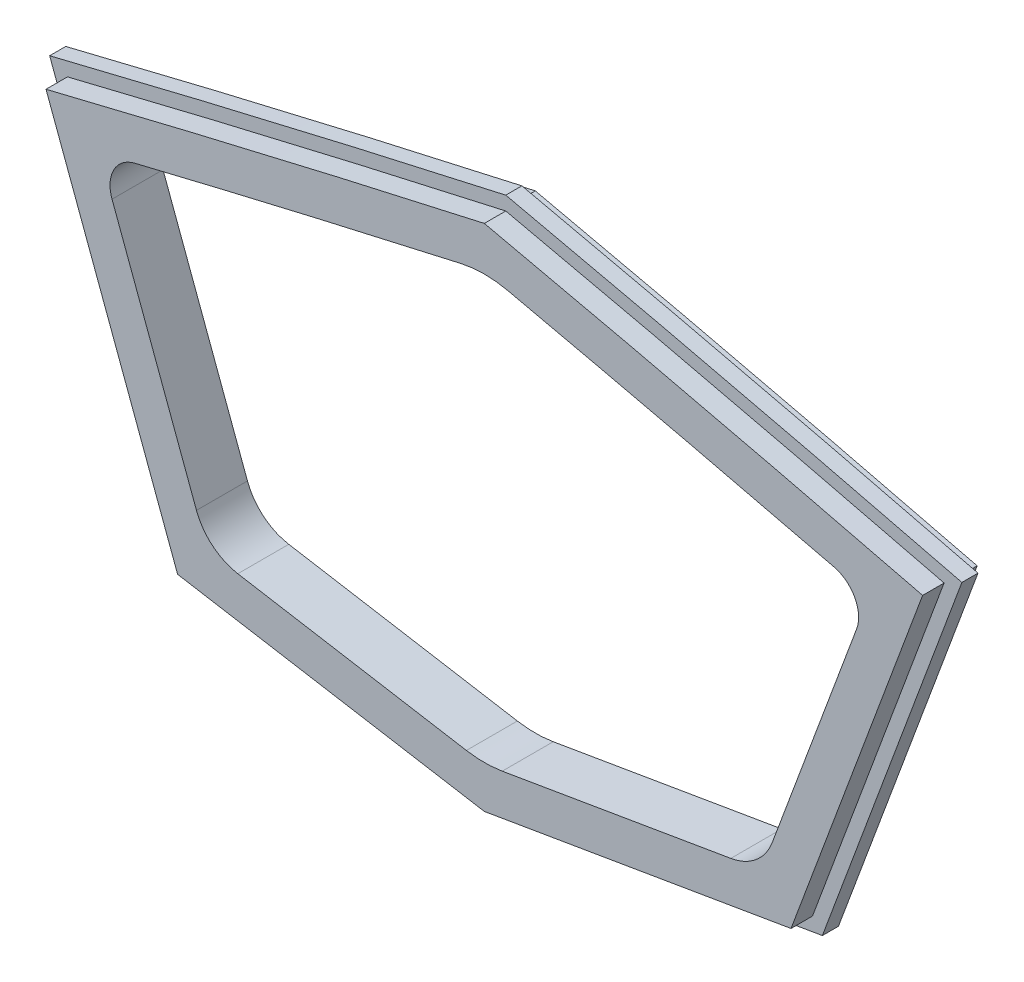
from build123d import *

# Parameters (mm, degrees)
BOSS_EXTRUDE1_DEPTH = 3
FILLET1_R           = 20
FILLET2_R           = 10
FILLET3_R           = 6
BOSS_EXTRUDE2_START = 4
BOSS_EXTRUDE2_DEPTH = 4
BOSS_EXTRUDE3_DEPTH = 2.5


with BuildPart() as part:
    # Sketch1 → Boss-Extrude1 (new body)
    with BuildSketch(Plane.XY):
        with BuildLine():
            Line((58.995636199, -70), (85.000010905, 5.7991e-05))
            add(Edge.make_bspline(
                [(85.000010905, 5.7991e-05), (56.750474686, 7.0174992), (28.420775895, 13.71150164), (7.678e-06, 19.999882532)],
                knots=[0, 0, 0, 0, 1, 1, 1, 1], degree=3))
            add(Edge.make_bspline(
                [(7.678e-06, 19.999882532), (-28.420729921, 13.711538103), (-56.750527687, 7.017544413), (-85.000042152, 0.000142104)],
                knots=[0, 0, 0, 0, 1, 1, 1, 1], degree=3))
            Line((-85.000042152, 0.000142104), (-58.995636199, -70))
            Line((-58.995636199, -70), (0, -80))
            Line((0, -80), (58.995636199, -70))
        make_face()
        with BuildLine():
            Line((51.632125707, -61.105504126), (71.72329576, -7.02294745))
            add(Edge.make_bspline(
                [(71.72329576, -7.02294745), (65.760246295, -5.560581522), (53.826176048, -2.665485282), (35.906371118, 1.582198174), (17.96537234, 5.730748209), (5.991311045, 8.427016674), (2.578e-06, 9.757206823)],
                knots=[0.12850852, 0.12850852, 0.12850852, 0.12850852, 0.340025725, 0.551542931, 0.763060137, 0.974577343, 0.974577343, 0.974577343, 0.974577343], degree=3))
            add(Edge.make_bspline(
                [(2.578e-06, 9.757206823), (-5.991303797, 8.427023399), (-17.965355756, 5.730769647), (-35.906372035, 1.582235194), (-53.826198007, -2.665432907), (-65.760270504, -5.560515659), (-71.723322613, -7.022875166)],
                knots=[0.025422687, 0.025422687, 0.025422687, 0.025422687, 0.236939832, 0.448456977, 0.659974121, 0.871491266, 0.871491266, 0.871491266, 0.871491266], degree=3))
            Line((-71.723322613, -7.022875166), (-51.632125707, -61.105504126))
            Line((-51.632125707, -61.105504126), (0, -69.857359184))
            Line((0, -69.857359184), (51.632125707, -61.105504126))
        make_face(mode=Mode.SUBTRACT)
    extrude(amount=BOSS_EXTRUDE1_DEPTH)

    # Fillet1
    fillet1_edges = [part.edges().sort_by_distance(p)[0] for p in [
        (0, -69.857359184, 1.5),
        (2.578e-06, 9.757206823, 1.5),
    ]]
    fillet(fillet1_edges, radius=FILLET1_R)

    # Fillet2
    fillet2_edges = [part.edges().sort_by_distance(p)[0] for p in [
        (51.632125707, -61.105504126, 1.5),
        (-51.632125707, -61.105504126, 1.5),
    ]]
    fillet(fillet2_edges, radius=FILLET2_R)

    # Fillet3
    fillet3_edges = [part.edges().sort_by_distance(p)[0] for p in [
        (71.72329576, -7.02294745, 1.5),
        (-71.723322613, -7.022875166, 1.5),
    ]]
    fillet(fillet3_edges, radius=FILLET3_R)

    # Sketch2 → Boss-Extrude2 (add)
    with BuildSketch(Plane.XY.offset(3).offset(BOSS_EXTRUDE2_START)):
        with BuildLine():
            Line((-81.681959277, -1.75265922), (-57.154758576, -67.776376032))
            Line((-57.154758576, -67.776376032), (0, -77.464339796))
            Line((0, -77.464339796), (57.154758576, -67.776376032))
            Line((57.154758576, -67.776376032), (81.681929126, -1.752740382))
            add(Edge.make_bspline(
                [(81.681929126, -1.752740382), (54.532239341, 4.970251393), (27.308171531, 11.391977282), (6.404e-06, 17.439367697)],
                knots=[0, 0, 0, 0, 1, 1, 1, 1], degree=3))
            add(Edge.make_bspline(
                [(6.404e-06, 17.439367697), (-27.308135136, 11.392011032), (-54.532288876, 4.970295529), (-81.681959277, -1.75265922)],
                knots=[0, 0, 0, 0, 1, 1, 1, 1], degree=3))
        make_face()
        with BuildLine():
            Line((-69.376008475, -13.341509152), (-53.642677645, -55.693385824))
            ThreePointArc((-53.642677645, -55.693385824), (-50.645602116, -59.913867336), (-45.939817671, -62.070373463))
            Line((-45.939817671, -62.070373463), (-3.342404912, -69.290807973))
            ThreePointArc((-3.342404912, -69.290807973), (0, -69.572077553), (3.342404912, -69.290807973))
            Line((3.342404912, -69.290807973), (45.939817671, -62.070373463))
            ThreePointArc((45.939817671, -62.070373463), (50.645602116, -59.913867336), (53.642677645, -55.693385824))
            Line((53.642677645, -55.693385824), (69.375984259, -13.341574337))
            ThreePointArc((69.375984259, -13.341574337), (69.05053211, -8.437764256), (65.169862303, -5.422192294))
            add(Edge.make_bspline(
                [(65.169862303, -5.422192294), (61.388993913, -4.502380085), (51.638475989, -2.146916169), (35.906371118, 1.582198174), (19.417348722, 5.39500343), (8.898318707, 7.771361324), (4.363182833, 8.785163741)],
                knots=[0.205976361, 0.205976361, 0.205976361, 0.205976361, 0.340025725, 0.551542931, 0.763060137, 0.923222679, 0.923222679, 0.923222679, 0.923222679], degree=3))
            ThreePointArc((4.363182833, 8.785163741), (2.348e-06, 9.266901295), (-4.363178618, 8.785168098))
            add(Edge.make_bspline(
                [(-4.363178618, 8.785168098), (-8.898311373, 7.771371135), (-19.41733449, 5.395025913), (-35.906372035, 1.582235194), (-51.638493171, -2.146865145), (-61.389012491, -4.502317987), (-65.169880027, -5.422125529)],
                knots=[0.076777369, 0.076777369, 0.076777369, 0.076777369, 0.236939832, 0.448456977, 0.659974121, 0.794023369, 0.794023369, 0.794023369, 0.794023369], degree=3))
            ThreePointArc((-65.169880027, -5.422125529), (-69.050554759, -8.437696121), (-69.376008475, -13.341509152))
        make_face(mode=Mode.SUBTRACT)
    extrude(amount=-BOSS_EXTRUDE2_DEPTH)

    # Sketch3 → Boss-Extrude3 (add)
    with BuildSketch(Plane(origin=(0, 0, 0), x_dir=(-1, 0, 0), z_dir=(0, 0, -1))):
        with BuildLine():
            Line((57.522934276, -68.221100795), (82.345641792, -1.401949233))
            add(Edge.make_bspline(
                [(82.345641792, -1.401949233), (54.976968444, 5.379009049), (27.531586141, 11.851868369), (0.000183244, 17.939432259)],
                knots=[-0.01124673, -0.01124673, -0.01124673, -0.01124673, 1.075105268, 1.075105268, 1.075105268, 1.075105268], degree=3))
            add(Edge.make_bspline(
                [(0.000183244, 17.939432259), (-27.531342023, 11.851872874), (-54.976750263, 5.379036047), (-82.345641148, -1.401950967)],
                knots=[-0.075105482, -0.075105482, -0.075105482, -0.075105482, 1.011252332, 1.011252332, 1.011252332, 1.011252332], degree=3))
            Line((-82.345641148, -1.401950967), (-57.522934276, -68.221100795))
            Line((-57.522934276, -68.221100795), (0, -77.971471837))
            Line((0, -77.971471837), (57.522934276, -68.221100795))
        make_face()
        with BuildLine():
            Line((-53.642677645, -55.693385824), (-69.375984259, -13.341574337))
            ThreePointArc((-69.375984259, -13.341574337), (-69.05053211, -8.437764256), (-65.169862303, -5.422192294))
            add(Edge.make_bspline(
                [(-65.169862303, -5.422192294), (-61.388993913, -4.502380085), (-51.638475989, -2.146916169), (-35.906371118, 1.582198174), (-19.417348722, 5.39500343), (-8.898318707, 7.771361324), (-4.363182833, 8.785163741)],
                knots=[0.205976361, 0.205976361, 0.205976361, 0.205976361, 0.340025725, 0.551542931, 0.763060137, 0.923222679, 0.923222679, 0.923222679, 0.923222679], degree=3))
            ThreePointArc((-4.363182833, 8.785163741), (-2.348e-06, 9.266901295), (4.363178618, 8.785168098))
            add(Edge.make_bspline(
                [(4.363178618, 8.785168098), (8.898311373, 7.771371135), (19.41733449, 5.395025913), (35.906372035, 1.582235194), (51.638493171, -2.146865145), (61.389012491, -4.502317987), (65.169880027, -5.422125529)],
                knots=[0.076777369, 0.076777369, 0.076777369, 0.076777369, 0.236939832, 0.448456977, 0.659974121, 0.794023369, 0.794023369, 0.794023369, 0.794023369], degree=3))
            ThreePointArc((65.169880027, -5.422125529), (69.050554759, -8.437696121), (69.376008475, -13.341509152))
            Line((69.376008475, -13.341509152), (53.642677645, -55.693385824))
            ThreePointArc((53.642677645, -55.693385824), (50.645602116, -59.913867336), (45.939817671, -62.070373463))
            Line((45.939817671, -62.070373463), (3.342404912, -69.290807973))
            ThreePointArc((3.342404912, -69.290807973), (0, -69.572077553), (-3.342404912, -69.290807973))
            Line((-3.342404912, -69.290807973), (-45.939817671, -62.070373463))
            ThreePointArc((-45.939817671, -62.070373463), (-50.645602116, -59.913867336), (-53.642677645, -55.693385824))
        make_face(mode=Mode.SUBTRACT)
    extrude(amount=BOSS_EXTRUDE3_DEPTH)


solid = part.part
